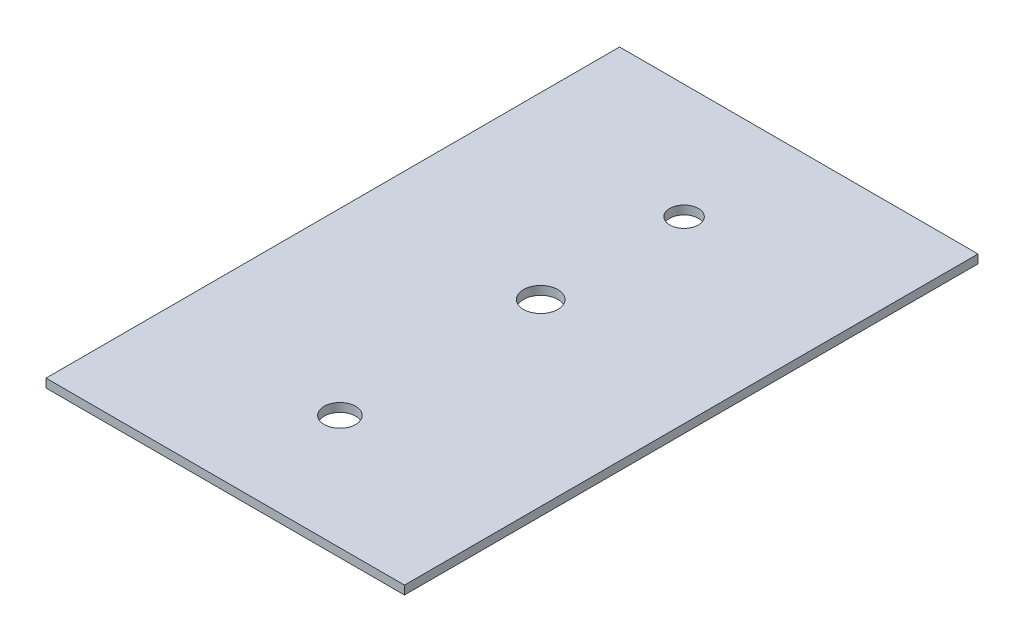
from build123d import *

# Parameters (mm, degrees)
SKETCH1_W           = 125
SKETCH1_H           = 200
BOSS_EXTRUDE1_DEPTH = 3
SKETCH2_R           = 5
SKETCH2_R_2         = 5.5
SKETCH2_R_3         = 6
CUT_EXTRUDE1_DEPTH  = 3


with BuildPart() as part:
    # Sketch1 → Boss-Extrude1 (new body)
    with BuildSketch(Plane(origin=(0, 0, 0), x_dir=(1, 0, 0), z_dir=(0, 1, 0))):
        Rectangle(SKETCH1_W, SKETCH1_H)
    extrude(amount=BOSS_EXTRUDE1_DEPTH)

    # Sketch2 → Cut-Extrude1 (cut)
    with BuildSketch(Plane(origin=(0, 3, 0), x_dir=(1, 0, 0), z_dir=(0, 1, 0))):
        with Locations(Location((0, 60, 0), (0, 0, 270))):
            Circle(SKETCH2_R)
        with Locations(Location((0, -60, 0), (0, 0, 270))):
            Circle(SKETCH2_R_2)
        with Locations(Location((0, 10, 0), (0, 0, 270))):
            Circle(SKETCH2_R_3)
    extrude(amount=-CUT_EXTRUDE1_DEPTH, mode=Mode.SUBTRACT)


solid = part.part
